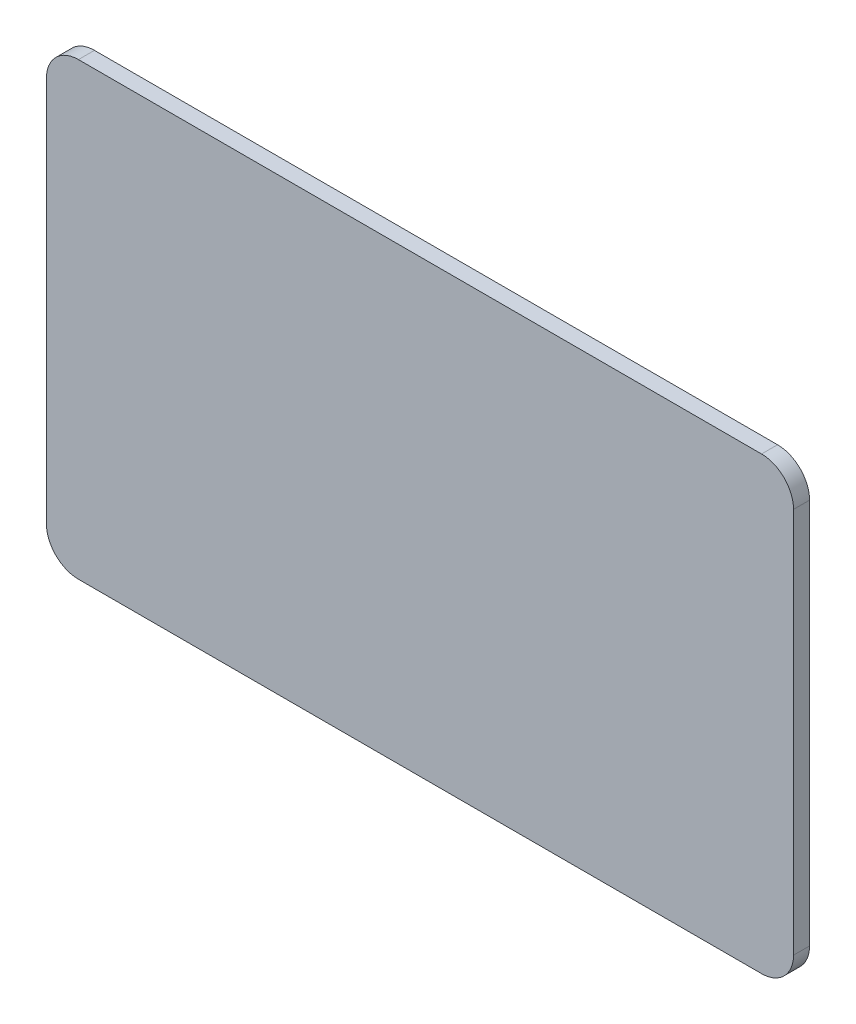
from build123d import *

# Parameters (mm, degrees)
SKETCH_1_W      = 46.699109992
SKETCH_1_H      = 28.132380741
EXTRUDE_1_DEPTH = 1
FILLET_1_R      = 2


with BuildPart() as part:
    # 草圖1 → 填料-伸長1 (new body)
    with BuildSketch(Plane.XY):
        with Locations((0, -3.217650397)):
            Rectangle(SKETCH_1_W, SKETCH_1_H)
    extrude(amount=EXTRUDE_1_DEPTH)

    # 圓角1
    fillet_1_edges = [part.edges().sort_by_distance(p)[0] for p in [
        (23.349554996, -17.283840768, 0.5),
        (-23.349554996, -17.283840768, 0.5),
        (-23.349554996, 10.848539973, 0.5),
        (23.349554996, 10.848539973, 0.5),
    ]]
    fillet(fillet_1_edges, radius=FILLET_1_R)


solid = part.part
